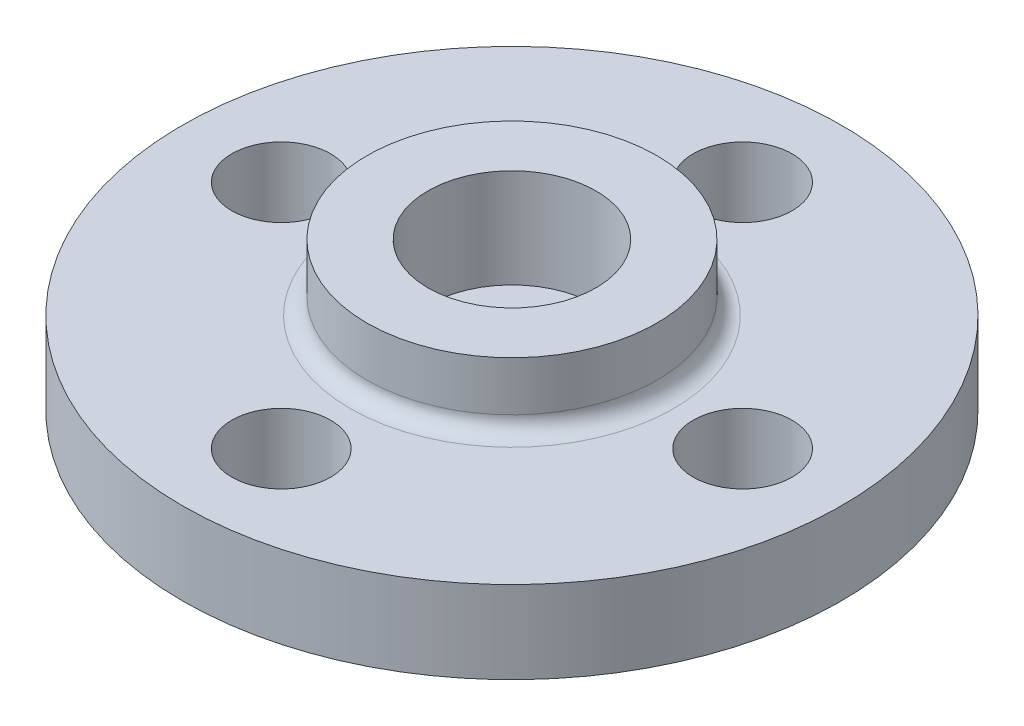
from build123d import *

# Parameters (mm, degrees)
SKETCH_1_R          = 10
SKETCH_1_R_2        = 1.5
EXTRUDE_1_DEPTH     = 2.5
SKETCH_2_R          = 4.4
SKETCH_2_R_2        = 2.55
EXTRUDE_2_DEPTH     = 2
FILLET_1_R          = 0.5
CUT_EXTRUDE_START   = -1
SKETCH_3_R          = 2.55
CUT_EXTRUDE_1_DEPTH = 1


with BuildPart() as part:
    # 草图1 → 凸台-拉伸1 (new body)
    with BuildSketch(Plane(origin=(0, 0, 0), x_dir=(1, 0, 0), z_dir=(0, 1, 0))):
        with Locations(Location((0, 0, 0), (0, 0, 270))):
            Circle(SKETCH_1_R)
        with Locations(Location((7, 0, 0), (0, 0, 270))):
            Circle(SKETCH_1_R_2, mode=Mode.SUBTRACT)
        with Locations(Location((0, 7, 0), (0, 0, 270))):
            Circle(SKETCH_1_R_2, mode=Mode.SUBTRACT)
        with Locations(Location((0, -7, 0), (0, 0, 270))):
            Circle(SKETCH_1_R_2, mode=Mode.SUBTRACT)
        with Locations(Location((-7, 0, 0), (0, 0, 270))):
            Circle(SKETCH_1_R_2, mode=Mode.SUBTRACT)
        with Locations(Location((0, 0, 0), (0, 0, 270))):
            Circle(SKETCH_1_R_2, mode=Mode.SUBTRACT)
    extrude(amount=EXTRUDE_1_DEPTH)

    # 草图2 → 凸台-拉伸2 (add)
    with BuildSketch(Plane(origin=(0, 2.5, 0), x_dir=(1, 0, 0), z_dir=(0, 1, 0))):
        with Locations(Location((0, 0, 0), (0, 0, 270))):
            Circle(SKETCH_2_R)
        with Locations(Location((0, 0, 0), (0, 0, 270))):
            Circle(SKETCH_2_R_2, mode=Mode.SUBTRACT)
    extrude(amount=EXTRUDE_2_DEPTH)

    # 圆角1
    fillet_1_edges = [part.edges().sort_by_distance(p)[0] for p in [
        (0, 2.5, -4.4),
    ]]
    fillet(fillet_1_edges, radius=FILLET_1_R)

    # 草图3 → 切除-拉伸1 (cut)
    with BuildSketch(Plane(origin=(0, 2.5, 0), x_dir=(1, 0, 0), z_dir=(0, 1, 0)).offset(CUT_EXTRUDE_START)):
        with Locations(Location((0, 0, 0), (0, 0, 270))):
            Circle(SKETCH_3_R)
    extrude(amount=CUT_EXTRUDE_1_DEPTH, mode=Mode.SUBTRACT)


solid = part.part
